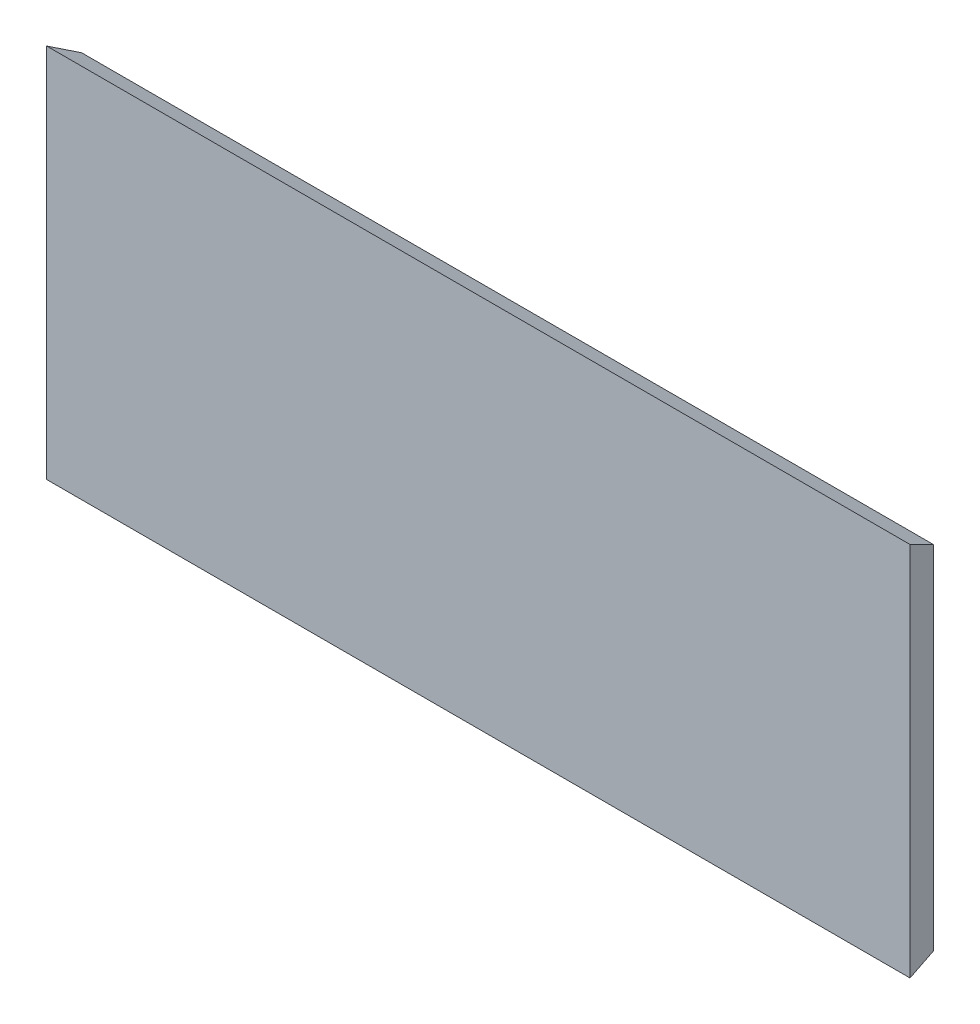
from build123d import *

# Parameters (mm, degrees)
SKETCH1_W           = 107.5
SKETCH1_H           = 23.5
BOSS_EXTRUDE1_DEPTH = 3
CUT_EXTRUDE1_DEPTH  = 109
CUT_EXTRUDE2_DEPTH  = 23.5
SKETCH4_W           = 107.387981152
SKETCH4_H           = 23.388196601
CUT_EXTRUDE3_DEPTH  = 0.1


with BuildPart() as part:
    # Sketch1 → Boss-Extrude1 (new body)
    with BuildSketch(Plane.XY):
        with Locations((53.75, 11.75)):
            Rectangle(SKETCH1_W, SKETCH1_H)
    boss_extrude1 = extrude(amount=BOSS_EXTRUDE1_DEPTH)

    # Sketch2 → Cut-Extrude1 (cut)
    with BuildSketch(Plane(origin=(107.5, 0, 0), x_dir=(0, 0, -1), z_dir=(1, 0, 0))):
        Polygon((-3.423606798, 23.6), (0.1, 21.838196601), (0.1, 23.6), align=None)
    cut_extrude1 = extrude(amount=-CUT_EXTRUDE1_DEPTH, mode=Mode.SUBTRACT)

    # Sketch3 → Cut-Extrude2 (cut)
    with BuildSketch(Plane.XZ):
        Polygon((-0.1, -0.1), (1.661792848, -0.1), (-0.1, 3.424099531), align=None)
    cut_extrude2 = extrude(amount=-CUT_EXTRUDE2_DEPTH, mode=Mode.SUBTRACT)

    # Sketch4 → Cut-Extrude3 (cut)
    with BuildSketch(Plane.XY.offset(3)):
        with Locations((53.806009424, 11.694098301)):
            Rectangle(SKETCH4_W, SKETCH4_H)
    cut_extrude3 = extrude(amount=-CUT_EXTRUDE3_DEPTH, mode=Mode.SUBTRACT)

    # Mirror2: Boss-Extrude1, Cut-Extrude1, Cut-Extrude2, Cut-Extrude3 across plane
    add(boss_extrude1.mirror(Plane(origin=(0, 0, 3), x_dir=(0, 0, 1), z_dir=(0, 1, 0))))
    add(cut_extrude1.mirror(Plane(origin=(0, 0, 3), x_dir=(0, 0, 1), z_dir=(0, 1, 0))), mode=Mode.SUBTRACT)
    add(cut_extrude2.mirror(Plane(origin=(0, 0, 3), x_dir=(0, 0, 1), z_dir=(0, 1, 0))), mode=Mode.SUBTRACT)
    add(cut_extrude3.mirror(Plane(origin=(0, 0, 3), x_dir=(0, 0, 1), z_dir=(0, 1, 0))), mode=Mode.SUBTRACT)


solid = part.part
